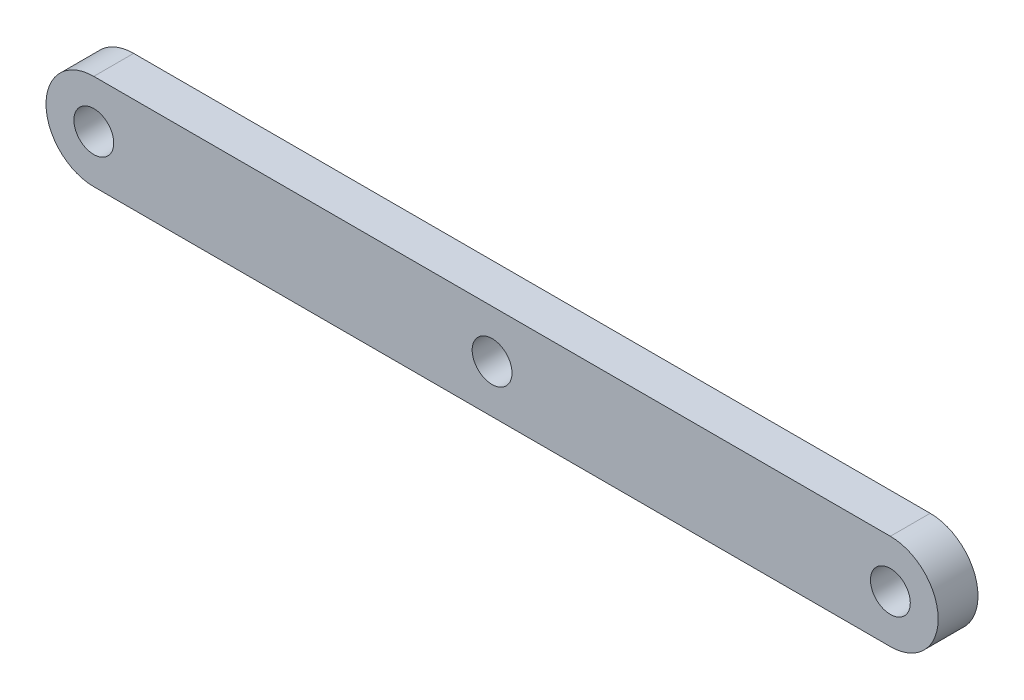
from build123d import *

# Parameters (mm, degrees)
SKETCH1_R           = 2.5
BOSS_EXTRUDE1_DEPTH = 2.5


with BuildPart() as part:
    # Sketch1 → Boss-Extrude1 (new, symmetric)
    with BuildSketch(Plane.XY):
        with BuildLine():
            Line((-50, 6), (50, 6))
            ThreePointArc((50, 6), (56, 0), (50, -6))
            Line((50, -6), (-50, -6))
            ThreePointArc((-50, -6), (-56, 0), (-50, 6))
        make_face()
        with Locations((-50, 0)):
            Circle(SKETCH1_R, mode=Mode.SUBTRACT)
        with Locations((50, 0)):
            Circle(SKETCH1_R, mode=Mode.SUBTRACT)
        Circle(SKETCH1_R, mode=Mode.SUBTRACT)
    extrude(amount=BOSS_EXTRUDE1_DEPTH, both=True)


solid = part.part
